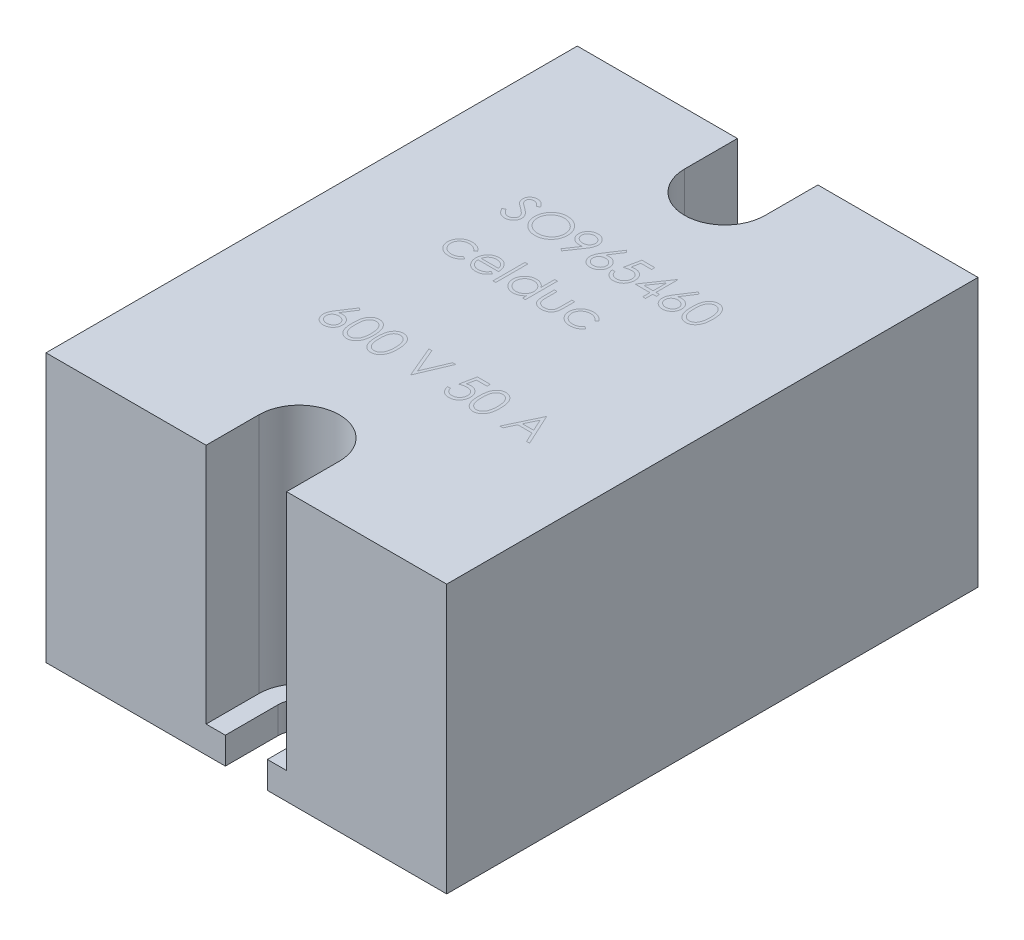
from build123d import *

# Parameters (mm, degrees)
SKETCH1_W           = 44.8
SKETCH1_H           = 59.4
BOSS_EXTRUDE1_DEPTH = 30
CUT_EXTRUDE1_DEPTH  = 27
CUT_EXTRUDE2_DEPTH  = 46.965748117


with BuildPart() as part:
    # Sketch1 → Boss-Extrude1 (new body)
    with BuildSketch(Plane(origin=(0, 0, 0), x_dir=(1, 0, 0), z_dir=(0, 1, 0))):
        Rectangle(SKETCH1_W, SKETCH1_H)
    extrude(amount=BOSS_EXTRUDE1_DEPTH)

    # Sketch3 → Cut-Extrude1 (cut)
    with BuildSketch(Plane(origin=(0, 30, 0), x_dir=(1, 0, 0), z_dir=(0, 1, 0))):
        with BuildLine():
            Line((-4.5, 23.8), (-4.5, 30.7))
            Line((-4.5, 30.7), (4.5, 30.7))
            Line((4.5, 30.7), (4.5, 23.8))
            ThreePointArc((4.5, 23.8), (0, 19.3), (-4.5, 23.8))
        make_face()
        with BuildLine():
            Line((-4.5, -23.8), (-4.5, -30.7))
            Line((-4.5, -30.7), (4.5, -30.7))
            Line((4.5, -30.7), (4.5, -23.8))
            ThreePointArc((4.5, -23.8), (0, -19.3), (-4.5, -23.8))
        make_face()
    extrude(amount=-CUT_EXTRUDE1_DEPTH, mode=Mode.SUBTRACT)

    # Sketch4 → Cut-Extrude2 (cut, through all)
    with BuildSketch(Plane(origin=(0, 3, 0), x_dir=(1, 0, 0), z_dir=(0, 1, 0))):
        with BuildLine():
            Line((-2.35, 23.8), (-2.35, 29.7))
            Line((-2.35, 29.7), (2.35, 29.7))
            Line((2.35, 29.7), (2.35, 23.8))
            ThreePointArc((2.35, 23.8), (0, 21.45), (-2.35, 23.8))
        make_face()
        with BuildLine():
            Line((-2.35, -23.8), (-2.35, -29.7))
            Line((-2.35, -29.7), (2.35, -29.7))
            Line((2.35, -29.7), (2.35, -23.8))
            ThreePointArc((2.35, -23.8), (0, -21.45), (-2.35, -23.8))
        make_face()
    extrude(amount=-CUT_EXTRUDE2_DEPTH, mode=Mode.SUBTRACT)


solid = part.part
